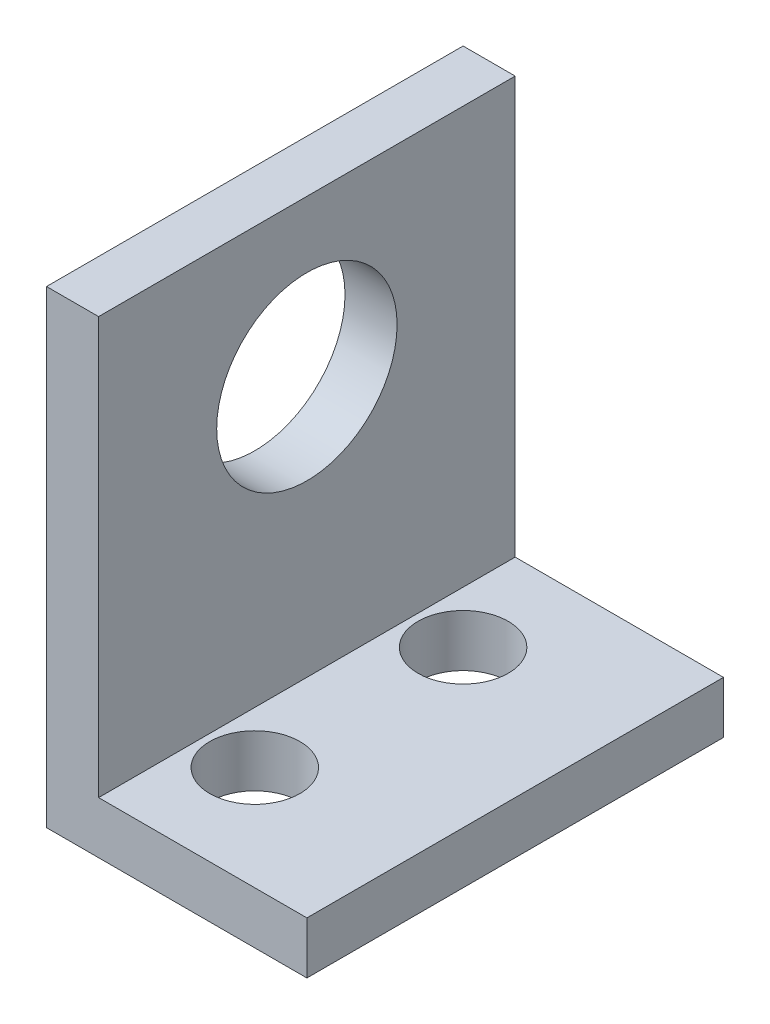
from build123d import *

# Parameters (mm, degrees)
BOSS_EXTRUDE1_DEPTH   = 25.4
M10_CLEARANCE_HOLE1_D = 11
M5_CLEARANCE_HOLE2_D  = 5.5


with BuildPart() as part:
    # Sketch1 → Boss-Extrude1 (new body)
    with BuildSketch(Plane.XY):
        Polygon((0, 0), (15.875, 0), (15.875, 3.175), (3.175, 3.175), (3.175, 28.575), (0, 28.575), align=None)
    extrude(amount=BOSS_EXTRUDE1_DEPTH)

    # M10 Clearance Hole1 (through all)
    with Locations(Plane(origin=(3.175, 0, 0), x_dir=(0, 0, -1), z_dir=(1, 0, 0))):
        with Locations((-12.7, 19.05)):
            Hole(M10_CLEARANCE_HOLE1_D / 2)

    # M5 Clearance Hole2 (through all)
    with Locations(Plane(origin=(0, 3.175, 0), x_dir=(1, 0, 0), z_dir=(0, 1, 0))):
        with Locations((6.35, -19.05), (6.35, -6.35)):
            Hole(M5_CLEARANCE_HOLE2_D / 2)


solid = part.part
